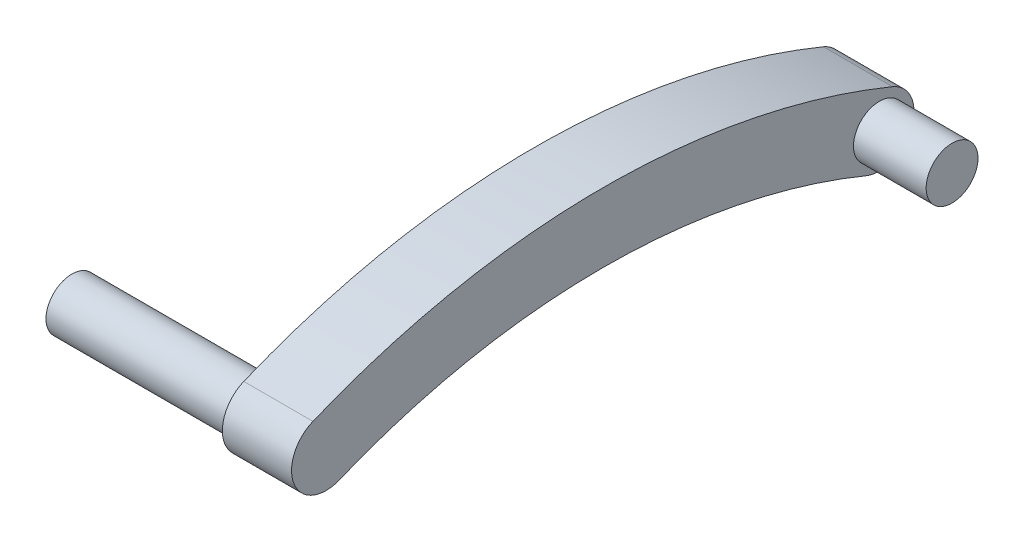
from build123d import *

# Parameters (mm, degrees)
BOSS_EXTRUDE1_DEPTH = 4
SKETCH2_R           = 1.5
BOSS_EXTRUDE2_DEPTH = 4.2
SKETCH3_R           = 1.5
BOSS_EXTRUDE3_DEPTH = 10.7


with BuildPart() as part:
    # Sketch1 → Boss-Extrude1 (new body)
    with BuildSketch(Plane(origin=(0, 0, 0), x_dir=(0, 0, -1), z_dir=(1, 0, 0))):
        with BuildLine():
            ThreePointArc((-0.761904762, 1.849189318), (-1.849189318, -0.761904762), (0.761904762, -1.849189318))
            ThreePointArc((0.761904762, -1.849189318), (16, 1.167024322), (31.238095238, -1.849189318))
            ThreePointArc((31.238095238, -1.849189318), (33.849189318, -0.761904762), (32.761904762, 1.849189318))
            ThreePointArc((32.761904762, 1.849189318), (16, 5.167024322), (-0.761904762, 1.849189318))
        make_face()
    extrude(amount=BOSS_EXTRUDE1_DEPTH)

    # Sketch2 → Boss-Extrude2 (add)
    with BuildSketch(Plane(origin=(4, 0, 0), x_dir=(0, 0, -1), z_dir=(1, 0, 0))):
        with Locations(Location((32, 0, 0), (0, 0, 180))):
            Circle(SKETCH2_R)
    extrude(amount=BOSS_EXTRUDE2_DEPTH)

    # Sketch3 → Boss-Extrude3 (add)
    with BuildSketch(Plane.ZY):
        Circle(SKETCH3_R)
    extrude(amount=BOSS_EXTRUDE3_DEPTH)


solid = part.part
